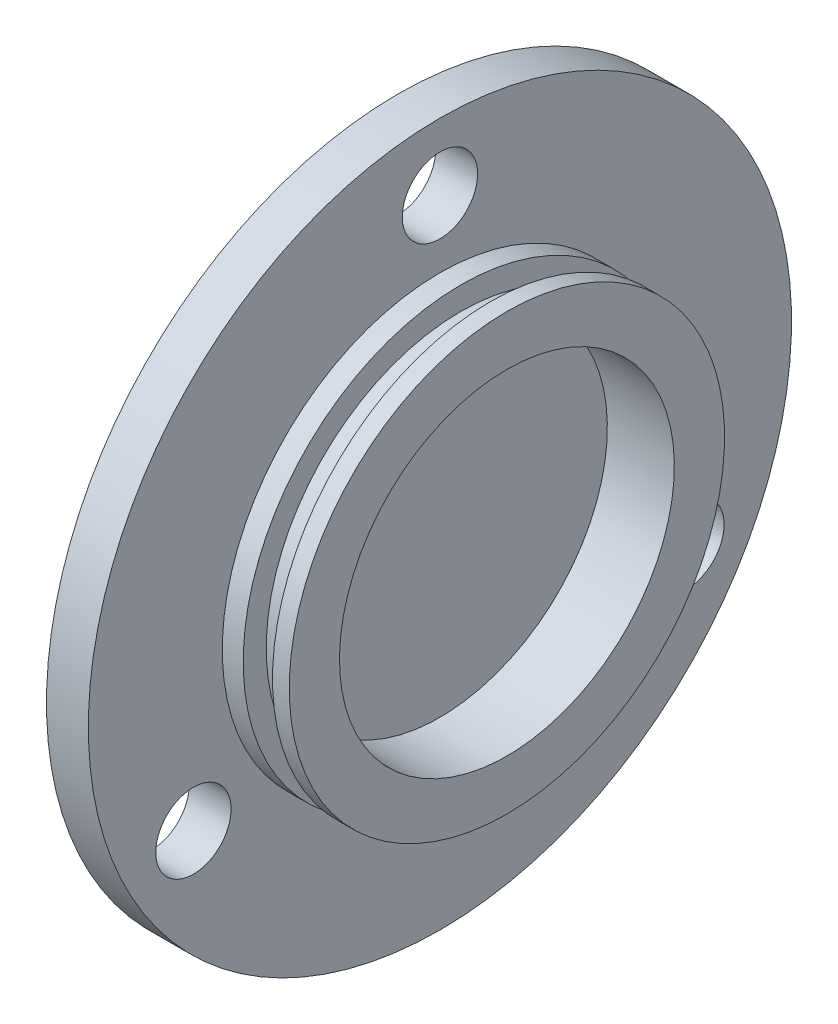
from build123d import *

# Parameters (mm, degrees)
SCHIZZO2_R               = 4.5
TAGLIO_ESTRUSIONE1_DEPTH = 60.933296255


with BuildPart() as part:
    # Schizzo1 → Rivoluzione1 (revolve)
    with BuildSketch(Plane.XY):
        Polygon((0, 0), (0, 42), (5, 42), (5, 26), (7.5, 26), (7.5, 23.25), (11, 23.25), (11, 26), (13, 26), (13, 20), (5, 20), (5, 0), align=None)
    revolve(axis=Axis((5, 0, 0), (-1, 0, 0)))

    # Schizzo2 → Taglio-Estrusione1 (cut, through all)
    with BuildSketch(Plane(origin=(5, 0, 0), x_dir=(0, 0, -1), z_dir=(1, 0, 0))):
        with Locations(Location((0, 34, 0), (0, 0, 90))):
            Circle(SCHIZZO2_R)
        with Locations(Location((29.444863729, -17, 0), (0, 0, 90))):
            Circle(SCHIZZO2_R)
        with Locations(Location((-29.444863729, -17, 0), (0, 0, 90))):
            Circle(SCHIZZO2_R)
    extrude(amount=-TAGLIO_ESTRUSIONE1_DEPTH, mode=Mode.SUBTRACT)


solid = part.part
